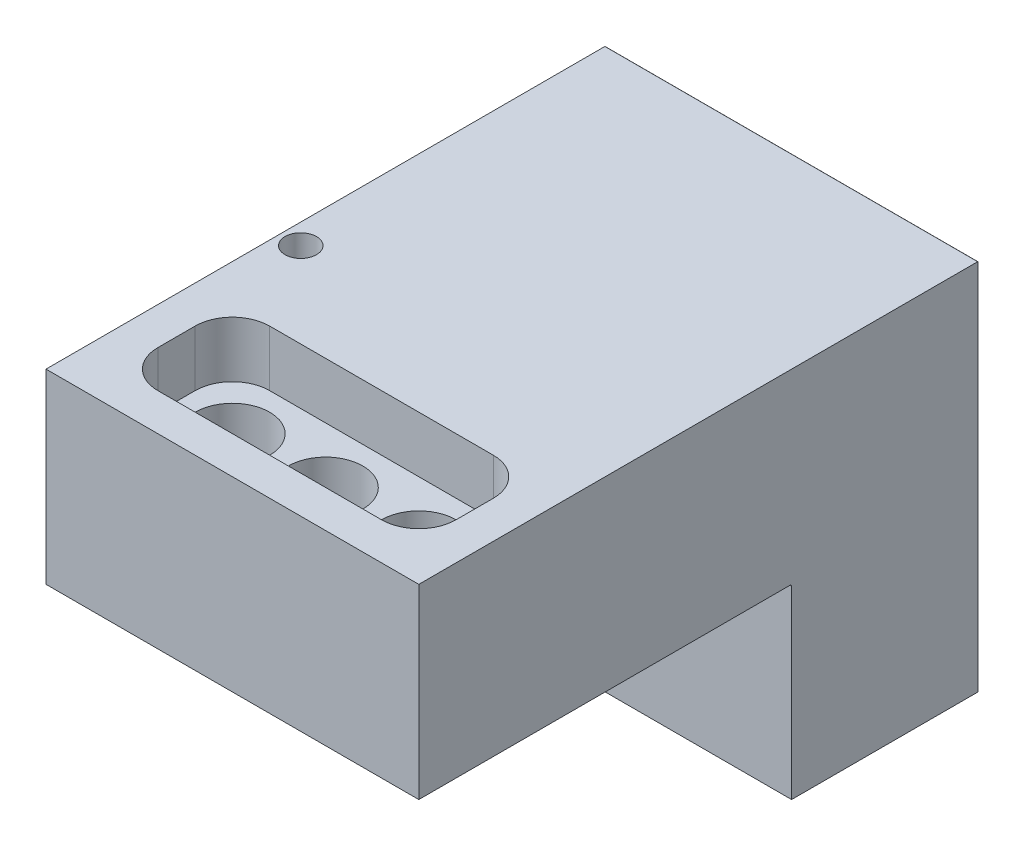
from build123d import *

# Parameters (mm, degrees)
SKETCH1_W           = 100
SKETCH1_H           = 100
BOSS_EXTRUDE1_DEPTH = 50
SKETCH3_W           = 80
SKETCH3_H           = 30
CUT_EXTRUDE2_DEPTH  = 15
FILLET1_R           = 10
SKETCH4_R           = 10
CUT_EXTRUDE3_DEPTH  = 15
SKETCH5_R           = 10
CUT_EXTRUDE4_DEPTH  = 146.688022843
SKETCH6_W           = 100
SKETCH6_H           = 50
BOSS_EXTRUDE2_DEPTH = 50
FILLET2_R           = 0.1
SKETCH7_R           = 4.224664999
CUT_EXTRUDE5_DEPTH  = 207.155281281
FILLET3_R           = 0.5


with BuildPart() as part:
    # Sketch1 → Boss-Extrude1 (new body)
    with BuildSketch(Plane(origin=(0, 0, 0), x_dir=(1, 0, 0), z_dir=(0, 1, 0))):
        with Locations((50, 50)):
            Rectangle(SKETCH1_W, SKETCH1_H)
    extrude(amount=BOSS_EXTRUDE1_DEPTH)

    # Sketch3 → Cut-Extrude2 (cut)
    with BuildSketch(Plane(origin=(0, 50, 0), x_dir=(1, 0, 0), z_dir=(0, 1, 0))):
        with Locations((50, 25)):
            Rectangle(SKETCH3_W, SKETCH3_H)
    extrude(amount=-CUT_EXTRUDE2_DEPTH, mode=Mode.SUBTRACT)

    # Fillet1
    fillet1_edges = [part.edges().sort_by_distance(p)[0] for p in [
        (90, 42.5, -10),
        (90, 42.5, -40),
        (10, 42.5, -40),
        (10, 42.5, -10),
    ]]
    fillet(fillet1_edges, radius=FILLET1_R)

    # Sketch4 → Cut-Extrude3 (cut)
    with BuildSketch(Plane(origin=(0, 35, 0), x_dir=(1, 0, 0), z_dir=(0, 1, 0))):
        with Locations((25, 25)):
            Circle(SKETCH4_R)
        with Locations((75, 25)):
            Circle(SKETCH4_R)
    extrude(amount=-CUT_EXTRUDE3_DEPTH, mode=Mode.SUBTRACT)

    # Sketch5 → Cut-Extrude4 (cut, through all)
    with BuildSketch(Plane(origin=(0, 35, 0), x_dir=(1, 0, 0), z_dir=(0, 1, 0))):
        with Locations((50, 25)):
            Circle(SKETCH5_R)
    extrude(amount=-CUT_EXTRUDE4_DEPTH, mode=Mode.SUBTRACT)

    # Sketch6 → Boss-Extrude2 (add, symmetric)
    with BuildSketch(Plane.XZ):
        with Locations((50, -125)):
            Rectangle(SKETCH6_W, SKETCH6_H)
    extrude(amount=BOSS_EXTRUDE2_DEPTH, both=True)

    # Fillet2
    fillet2_edges = [part.edges().sort_by_distance(p)[0] for p in [
        (50, 50, -150),
    ]]
    fillet(fillet2_edges, radius=FILLET2_R)

    # Sketch7 → Cut-Extrude5 (cut, through all)
    with BuildSketch(Plane(origin=(0, 50, 0), x_dir=(1, 0, 0), z_dir=(0, 1, 0))):
        with Locations((5.480381348, 62.854130386)):
            Circle(SKETCH7_R)
    extrude(amount=-CUT_EXTRUDE5_DEPTH, mode=Mode.SUBTRACT)

    # Fillet3
    fillet3_edges = [part.edges().sort_by_distance(p)[0] for p in [
        (50, 0, -100),
    ]]
    fillet(fillet3_edges, radius=FILLET3_R)


solid = part.part
